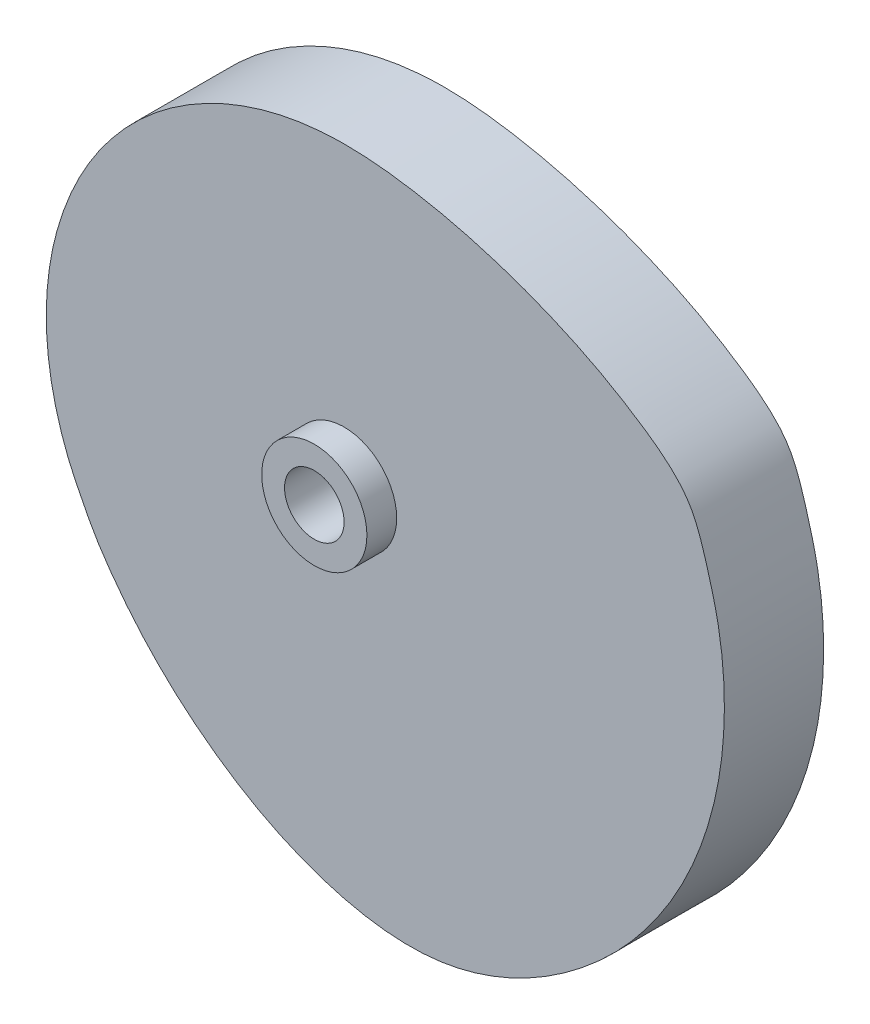
from build123d import *

# Parameters (mm, degrees)
BOSS_EXTRUDE2_DEPTH = 50
SKETCH4_R           = 30
CUT_EXTRUDE1_DEPTH  = 120
BOSS_EXTRUDE5_START = 30
SKETCH5_R           = 53
SKETCH5_R_2         = 30
BOSS_EXTRUDE5_DEPTH = 30


with BuildPart() as part:
    # Sketch2 → Boss-Extrude2 (new, symmetric)
    with BuildSketch(Plane.XY):
        with BuildLine():
            add(Edge.make_bspline(
                [(0, 300), (28.217284294, 300.11283811), (66.276595047, 295.282252174), (111.565208623, 285.423132424), (161.284807347, 272.184396433), (209.235589382, 254.280823699), (261.44517078, 228.313222156), (297.292905913, 206.82569069), (327.504630593, 185.222847046), (352.626738941, 156.041805916), (364.770823043, 118.585486356), (379.665136205, 63.607159754), (385.609143923, -4.494715253), (379.403431029, -61.933062843), (365.395926356, -118.456456886), (347.285627362, -166.480326076), (315.570685665, -219.654716634), (276.37254477, -267.847841335), (238.171213694, -301.613772527), (180.451433663, -340.514495361), (129.998904787, -361.653313602), (49.238193524, -370.13103158), (-37.249984375, -353.541488623), (-132.261264159, -299.789278474), (-195.504173635, -241.717489505), (-232.091752611, -195.93812123), (-251.676728283, -166.831639165), (-264.947338, -140.575383928), (-276.179761459, -118.494733203), (-289.382474634, -82.881152812), (-299.388681325, -37.618334316), (-301.025459771, 17.343506401), (-290.389842377, 90.764328737), (-252.463458386, 173.744069129), (-183.726156385, 242.286967385), (-116.054741078, 279.32577832), (-55.775867571, 296.630730618), (-17.964920472, 299.928160072), (0, 300)],
                knots=[0, 0, 0, 0, 0.039986785, 0.053990786, 0.065758964, 0.112949929, 0.126217292, 0.148413251, 0.172286891, 0.178369732, 0.202736339, 0.226604212, 0.259581526, 0.2988604, 0.307907188, 0.342171357, 0.371156013, 0.395355152, 0.430074093, 0.442890692, 0.494201301, 0.504983741, 0.557915928, 0.615297228, 0.658028611, 0.678834066, 0.698358603, 0.70762895, 0.720547532, 0.733466114, 0.76141031, 0.785860238, 0.811057769, 0.866204857, 0.911632799, 0.946453902, 0.974541866, 1, 1, 1, 1], degree=3))
        make_face()
    extrude(amount=BOSS_EXTRUDE2_DEPTH, both=True)

    # Sketch4 → Cut-Extrude1 (cut, symmetric)
    with BuildSketch(Plane.XY):
        Circle(SKETCH4_R)
    extrude(amount=CUT_EXTRUDE1_DEPTH, both=True, mode=Mode.SUBTRACT)

    # Sketch5 → Boss-Extrude5 (add)
    with BuildSketch(Plane.XY.offset(50).offset(BOSS_EXTRUDE5_START)):
        Circle(SKETCH5_R)
        Circle(SKETCH5_R_2, mode=Mode.SUBTRACT)
    boss_extrude5 = extrude(amount=-BOSS_EXTRUDE5_DEPTH)

    # Mirror1: Boss-Extrude5 across plane
    add(boss_extrude5.mirror(Plane.XY))


solid = part.part
